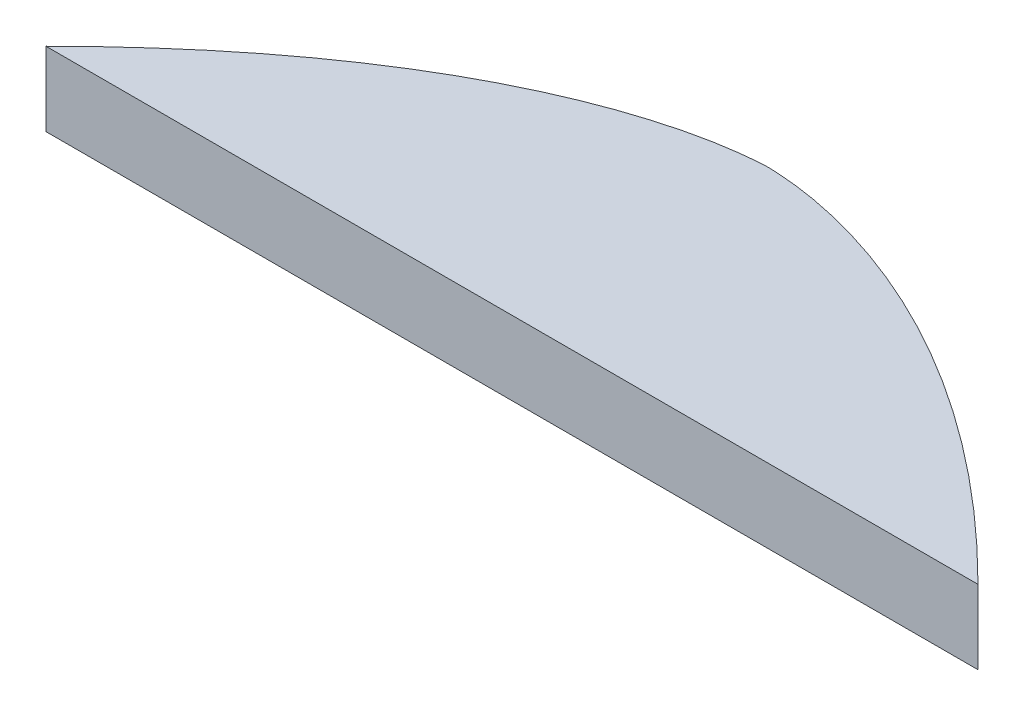
from build123d import *

# Parameters (mm, degrees)
BOSS_EXTRUDE1_DEPTH = 6.35


with BuildPart() as part:
    # Sketch1 → Boss-Extrude1 (new body)
    with BuildSketch(Plane(origin=(0, 0, 0), x_dir=(1, 0, 0), z_dir=(0, 1, 0))):
        with BuildLine():
            Line((0, 0), (40, 0))
            add(Edge.make_bspline(
                [(-40, 0), (-18.786796564, 21.213203436), (0.966290132, 21.98312806), (-0.916771007, 22.026997476), (18.786796564, 21.213203436), (40, 0)],
                knots=[0, 0, 0, 0, 0.255671239, 0.308531044, 0.528598046, 0.528598046, 0.528598046, 0.528598046], degree=3))
            Line((-40, 0), (0, 0))
        make_face()
    extrude(amount=BOSS_EXTRUDE1_DEPTH)


solid = part.part
